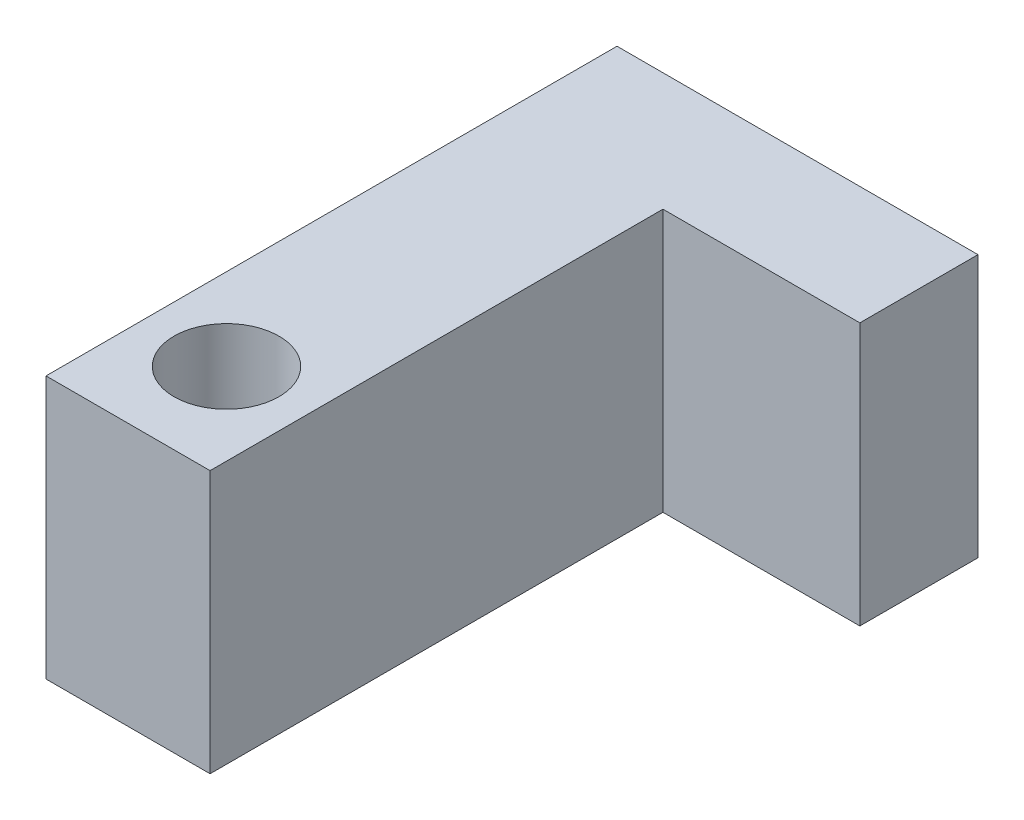
from build123d import *

# Parameters (mm, degrees)
SKETCH1_R           = 0.4
BOSS_EXTRUDE1_DEPTH = 2


with BuildPart() as part:
    # Sketch1 → Boss-Extrude1 (new body)
    with BuildSketch(Plane(origin=(0, 0, 0), x_dir=(1, 0, 0), z_dir=(0, 1, 0))):
        Polygon((-43.144042746, 25.259159104), (-43.144042746, 29.609159104), (-40.394042746, 29.609159104), (-40.394042746, 28.709159104), (-41.894042746, 28.709159104), (-41.894042746, 25.259159104), align=None)
        with Locations(Location((-42.519042746, 26.009159104, 0), (0, 0, 270))):
            Circle(SKETCH1_R, mode=Mode.SUBTRACT)
    extrude(amount=BOSS_EXTRUDE1_DEPTH)


solid = part.part
